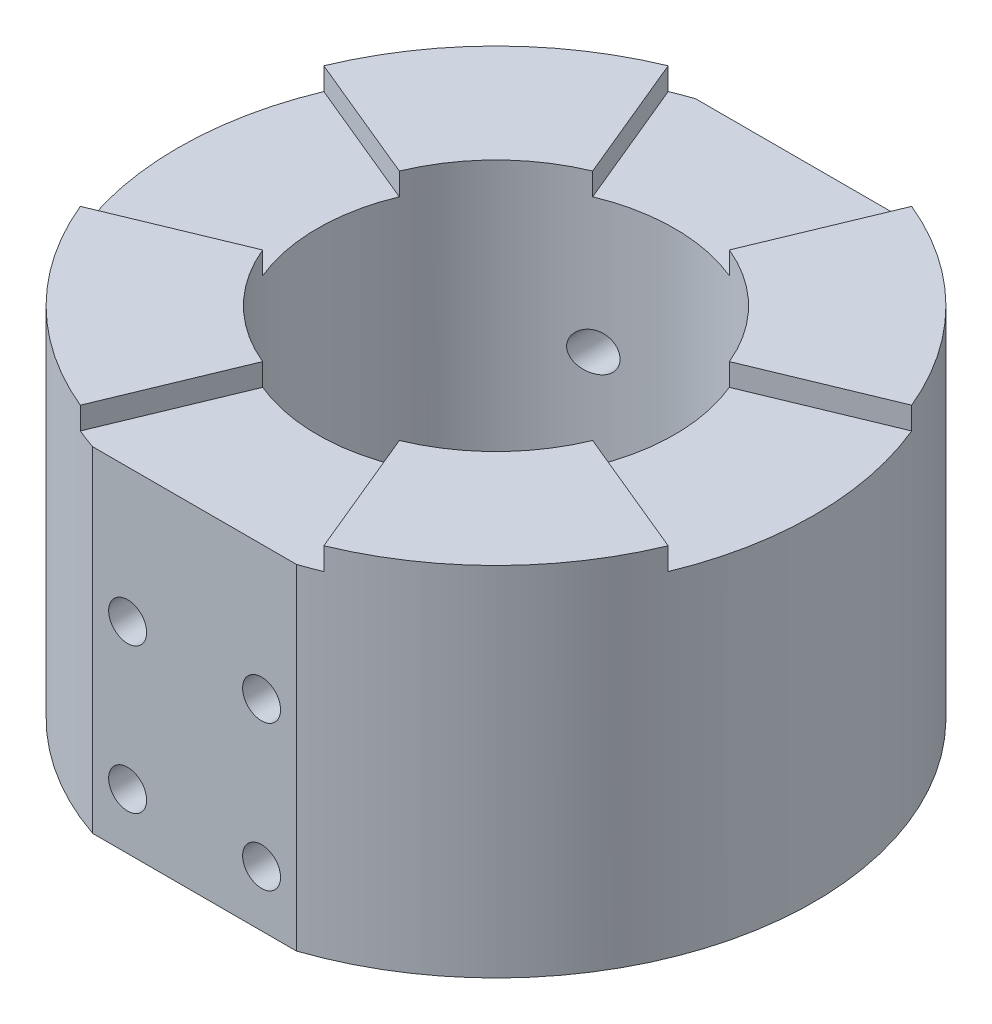
from build123d import *

# Parameters (mm, degrees)
SKETCH_1_R               = 142.5
SKETCH_1_R_2             = 80
EXTRUDE_1_DEPTH          = 160
CUT_EXTRUDE_START        = -10
CUT_EXTRUDE_1_DEPTH      = 10
PATTERN_CIRCULAR_1_COUNT = 4
CUT_EXTRUDE_2_DEPTH      = 258.317896774
CUT_EXTRUDE_2_DEPTH_BACK = 258.317896774
SKETCH_3_W               = 17.844530797
SKETCH_3_H               = 166.856843943
SKETCH_3_W_2             = 22.841371227
CUT_EXTRUDE_3_REACH      = 346.683
CUT_EXTRUDE_3_END_RADIUS = 80
SKETCH_4_R               = 8.5


with BuildPart() as part:
    # 草图1 → 凸台-拉伸1 (new body)
    with BuildSketch(Plane(origin=(0, 0, 0), x_dir=(1, 0, 0), z_dir=(0, 1, 0))):
        with Locations(Location((0, 0, 0), (0, 0, 270))):
            Circle(SKETCH_1_R)
        with Locations(Location((0, 0, 0), (0, 0, 270))):
            Circle(SKETCH_1_R_2, mode=Mode.SUBTRACT)
    extrude(amount=EXTRUDE_1_DEPTH)

    # 草图2 → 切除-拉伸1 (cut)
    with BuildSketch(Plane(origin=(0, 160, 0), x_dir=(1, 0, 0), z_dir=(0, 1, 0)).offset(CUT_EXTRUDE_START)):
        with BuildLine():
            Line((-54.532389112, 131.652833383), (-30.614674589, 73.910362601))
            ThreePointArc((-30.614674589, 73.910362601), (0, 80), (30.614674589, 73.910362601))
            Line((30.614674589, 73.910362601), (54.532389112, 131.652833383))
            ThreePointArc((54.532389112, 131.652833383), (0, 142.5), (-54.532389112, 131.652833383))
        make_face()
    cut_extrude_1 = extrude(amount=CUT_EXTRUDE_1_DEPTH, mode=Mode.SUBTRACT)

    # 阵列(圆周)1: 切除-拉伸1 ×4 about axis
    pattern_circular_1_axis = Axis((0, 160, 0), (0, -1, 0))
    for i in range(1, PATTERN_CIRCULAR_1_COUNT):
        add(cut_extrude_1.rotate(pattern_circular_1_axis, i * 360 / PATTERN_CIRCULAR_1_COUNT), mode=Mode.SUBTRACT)

    # 草图3 → 切除-拉伸2 (cut, two sides: drawn at the far end of the back side and taken through both)
    with BuildSketch(Plane(origin=(0, 0, 0), x_dir=(0, 0, -1), z_dir=(1, 0, 0)).offset(-CUT_EXTRUDE_2_DEPTH_BACK)):
        with Locations((143.922265399, 83.428421972)):
            Rectangle(SKETCH_3_W, SKETCH_3_H)
        with Locations((-146.420685613, 83.428421972)):
            Rectangle(SKETCH_3_W_2, SKETCH_3_H)
    extrude(amount=CUT_EXTRUDE_2_DEPTH + CUT_EXTRUDE_2_DEPTH_BACK, mode=Mode.SUBTRACT)

    # 切除-拉伸3: up to this cylinder (the profile starts outside it)
    cut_extrude_3_end = Plane(origin=(0, 57.5, 0), z_dir=(0, -1, 0)) * Cylinder(CUT_EXTRUDE_3_END_RADIUS, 919.366, mode=Mode.PRIVATE)
    # 草图4 → 切除-拉伸3 (cut, up to the surface)
    with BuildSketch(Plane.XY.offset(135), mode=Mode.PRIVATE) as cut_extrude_3_sk1:
        with Locations((-30, 90)):
            Circle(SKETCH_4_R)
    cut_extrude_3_tool1 = extrude(cut_extrude_3_sk1.sketch, amount=-CUT_EXTRUDE_3_REACH, mode=Mode.PRIVATE) - cut_extrude_3_end
    # 草图4 → 切除-拉伸3 (cut, up to the surface)
    with BuildSketch(Plane.XY.offset(135), mode=Mode.PRIVATE) as cut_extrude_3_sk2:
        with Locations((30, 90)):
            Circle(SKETCH_4_R)
    cut_extrude_3_tool2 = extrude(cut_extrude_3_sk2.sketch, amount=-CUT_EXTRUDE_3_REACH, mode=Mode.PRIVATE) - cut_extrude_3_end
    # 草图4 → 切除-拉伸3 (cut, up to the surface)
    with BuildSketch(Plane.XY.offset(135), mode=Mode.PRIVATE) as cut_extrude_3_sk3:
        with Locations((30, 25)):
            Circle(SKETCH_4_R)
    cut_extrude_3_tool3 = extrude(cut_extrude_3_sk3.sketch, amount=-CUT_EXTRUDE_3_REACH, mode=Mode.PRIVATE) - cut_extrude_3_end
    # 草图4 → 切除-拉伸3 (cut, up to the surface)
    with BuildSketch(Plane.XY.offset(135), mode=Mode.PRIVATE) as cut_extrude_3_sk4:
        with Locations((-30, 25)):
            Circle(SKETCH_4_R)
    cut_extrude_3_tool4 = extrude(cut_extrude_3_sk4.sketch, amount=-CUT_EXTRUDE_3_REACH, mode=Mode.PRIVATE) - cut_extrude_3_end
    cut_extrude_3 = cut_extrude_3_tool1.solids().sort_by_distance((-30, 90, 135))[0] + cut_extrude_3_tool2.solids().sort_by_distance((30, 90, 135))[0] + cut_extrude_3_tool3.solids().sort_by_distance((30, 25, 135))[0] + cut_extrude_3_tool4.solids().sort_by_distance((-30, 25, 135))[0]
    add(cut_extrude_3, mode=Mode.SUBTRACT)

    # 镜向1: 切除-拉伸3 across plane
    add(cut_extrude_3.mirror(Plane.XY), mode=Mode.SUBTRACT)


solid = part.part
